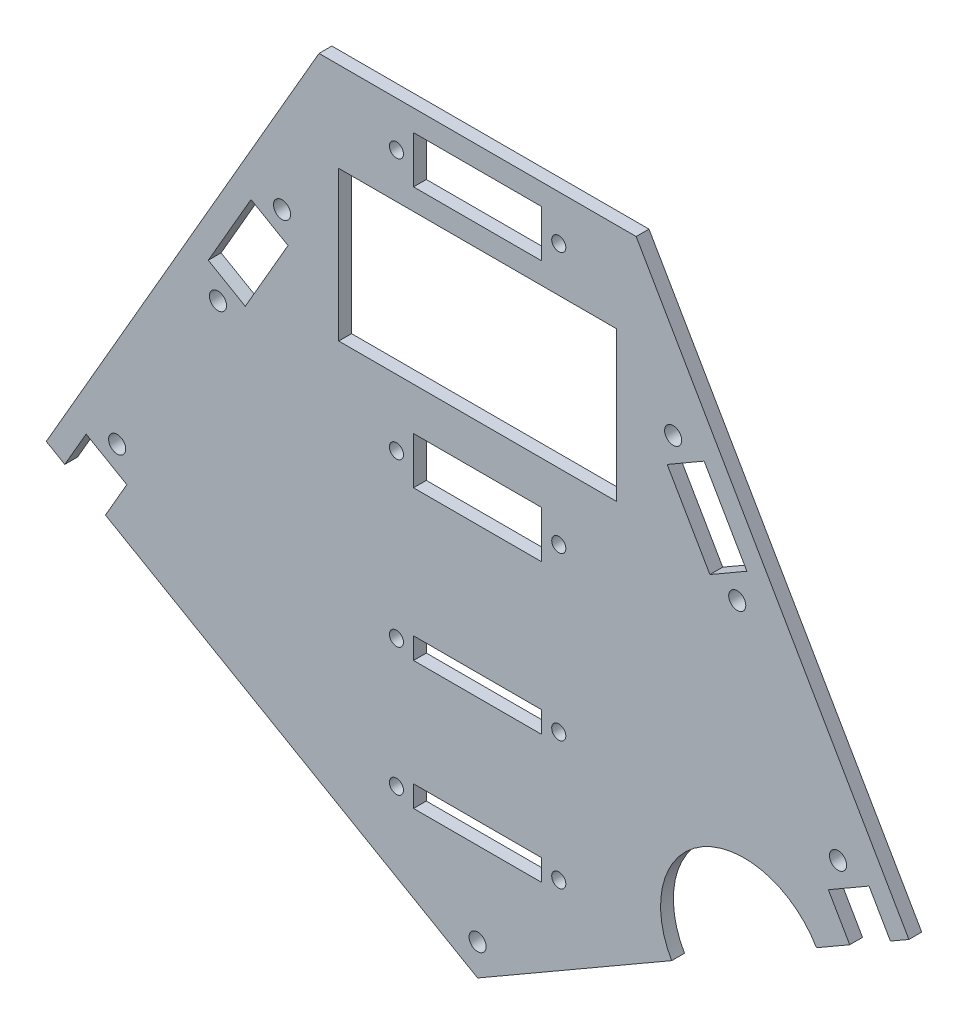
from build123d import *

# Parameters (mm, degrees)
ESQUISSE1_R             = 2
ESQUISSE1_R_2           = 1.65
ESQUISSE1_W             = 65
ESQUISSE1_H             = 35
ESQUISSE1_W_2           = 30
ESQUISSE1_H_2           = 5
ESQUISSE1_H_3           = 11
BOSS_EXTRU_1_DEPTH      = 3
ENL_V_MAT_EXTRU_1_DEPTH = 10


with BuildPart() as part:
    # Esquisse1 → Boss.-Extru.1 (new body)
    with BuildSketch(Plane.XY):
        Polygon((37.118802154, 168.871977627), (100.962812921, 58.290907218), (96.632685902, 55.790907218), (91.632685902, 64.451161256), (82.106406461, 58.951161256), (87.106406461, 50.290907218), (0, 0), (-87.106406461, 50.290907218), (-82.106406461, 58.951161256), (-91.632685902, 64.451161256), (-96.632685902, 55.790907218), (-100.962812921, 58.290907218), (-37.118802154, 168.871977627), align=None)
        with Locations((-84.369546181, 66.031288275)):
            Circle(ESQUISSE1_R, mode=Mode.SUBTRACT)
        with Locations((84.369546181, 66.031288275)):
            Circle(ESQUISSE1_R, mode=Mode.SUBTRACT)
        with Locations((-19, 97.371977627)):
            Circle(ESQUISSE1_R_2, mode=Mode.SUBTRACT)
        with Locations((19, 97.371977627)):
            Circle(ESQUISSE1_R_2, mode=Mode.SUBTRACT)
        with Locations((19, 158.371977627)):
            Circle(ESQUISSE1_R_2, mode=Mode.SUBTRACT)
        with Locations((-19, 158.371977627)):
            Circle(ESQUISSE1_R_2, mode=Mode.SUBTRACT)
        with Locations((-19, 59.371977627)):
            Circle(ESQUISSE1_R_2, mode=Mode.SUBTRACT)
        with Locations((0, 7.342924489)):
            Circle(ESQUISSE1_R, mode=Mode.SUBTRACT)
        with Locations((19, 59.371977627)):
            Circle(ESQUISSE1_R_2, mode=Mode.SUBTRACT)
        with Locations((19, 29.371977627)):
            Circle(ESQUISSE1_R_2, mode=Mode.SUBTRACT)
        with Locations((-19, 29.371977627)):
            Circle(ESQUISSE1_R_2, mode=Mode.SUBTRACT)
        with Locations((-45.775934694, 132.877384219)):
            Circle(ESQUISSE1_R, mode=Mode.SUBTRACT)
        with Locations((-60.775934694, 106.896622105)):
            Circle(ESQUISSE1_R, mode=Mode.SUBTRACT)
        with Locations((60.775934694, 106.896622105)):
            Circle(ESQUISSE1_R, mode=Mode.SUBTRACT)
        with Locations((45.775934694, 132.877384219)):
            Circle(ESQUISSE1_R, mode=Mode.SUBTRACT)
        with Locations((0, 130.371977627)):
            Rectangle(ESQUISSE1_W, ESQUISSE1_H, mode=Mode.SUBTRACT)
        with Locations((0, 59.371977627)):
            Rectangle(ESQUISSE1_W_2, ESQUISSE1_H_2, mode=Mode.SUBTRACT)
        with Locations((0, 29.371977627)):
            Rectangle(ESQUISSE1_W_2, ESQUISSE1_H_2, mode=Mode.SUBTRACT)
        with Locations((0, 97.371977627)):
            Rectangle(ESQUISSE1_W_2, ESQUISSE1_H_3, mode=Mode.SUBTRACT)
        Polygon((-53.039074415, 131.2972572), (-63.039074415, 113.976749124), (-54.378820377, 108.976749124), (-44.378820377, 126.2972572), align=None, mode=Mode.SUBTRACT)
        Polygon((63.039074415, 113.976749124), (54.378820377, 108.976749124), (44.378820377, 126.2972572), (53.039074415, 131.2972572), align=None, mode=Mode.SUBTRACT)
        with Locations((0, 158.371977627)):
            Rectangle(ESQUISSE1_W_2, ESQUISSE1_H_3, mode=Mode.SUBTRACT)
    extrude(amount=BOSS_EXTRU_1_DEPTH)

    # Esquisse2 → Enlèv. mat.-Extru.1 (cut)
    with BuildSketch(Plane(origin=(0, 0, 0), x_dir=(-1, 0, 0), z_dir=(0, 0, -1))):
        with BuildLine():
            Line((-45.427639482, 26.227659884), (-79.321398517, 45.796230786))
            ThreePointArc((-79.321398517, 45.796230786), (-52.612809671, 52.91972186), (-45.427639482, 26.227659884))
        make_face()
    extrude(amount=-ENL_V_MAT_EXTRU_1_DEPTH, mode=Mode.SUBTRACT)


solid = part.part
